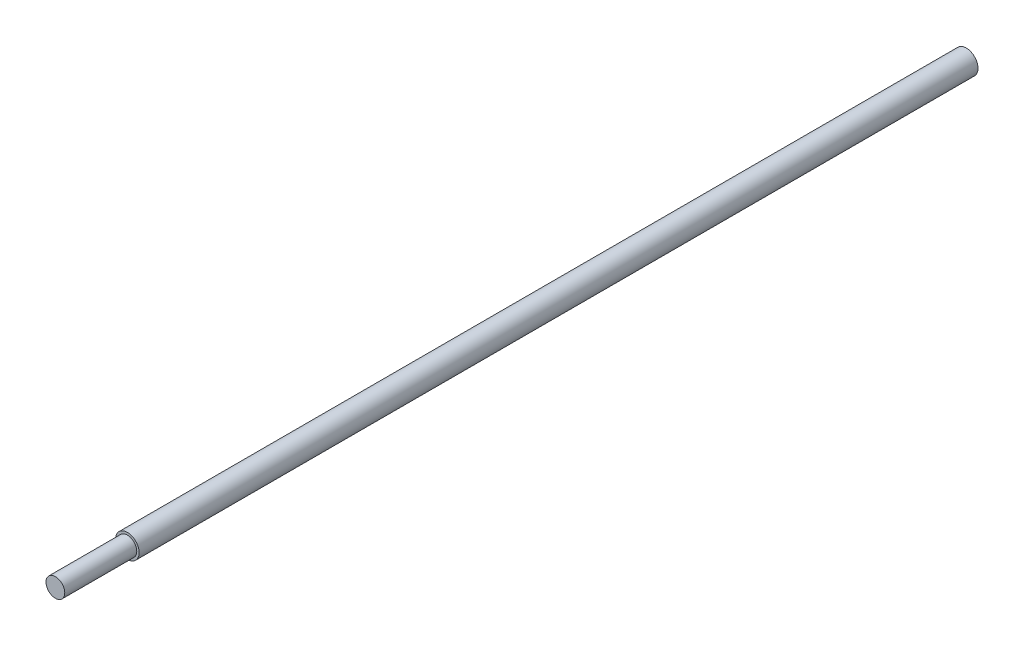
from build123d import *

# Parameters (mm, degrees)
SKETCH1_R           = 7.5
BOSS_EXTRUDE1_DEPTH = 536
SKETCH2_R           = 6
BOSS_EXTRUDE2_DEPTH = 46


with BuildPart() as part:
    # Sketch1 → Boss-Extrude1 (new body)
    with BuildSketch(Plane.XY):
        Circle(SKETCH1_R)
    extrude(amount=BOSS_EXTRUDE1_DEPTH)

    # Sketch2 → Boss-Extrude2 (add)
    with BuildSketch(Plane.XY.offset(536)):
        Circle(SKETCH2_R)
    extrude(amount=BOSS_EXTRUDE2_DEPTH)


solid = part.part
